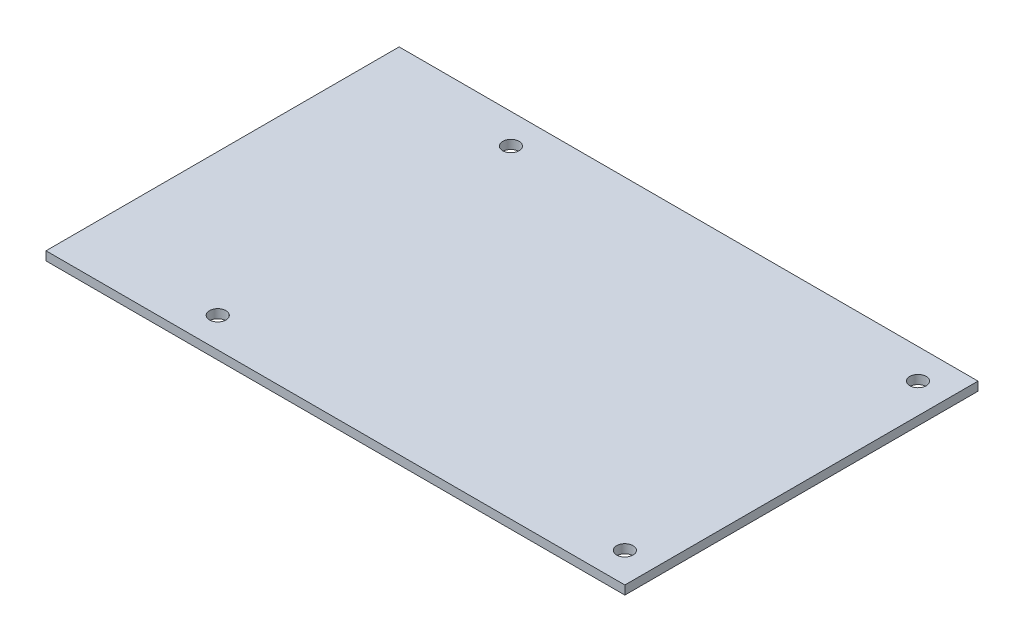
from build123d import *

# Parameters (mm, degrees)
SKETCH1_W           = 106.172
SKETCH1_H           = 64.77
BOSS_EXTRUDE1_DEPTH = 1.6129
SKETCH2_R           = 1.5
CUT_EXTRUDE1_DEPTH  = 1.6129


with BuildPart() as part:
    # Sketch1 → Boss-Extrude1 (new body)
    with BuildSketch(Plane(origin=(0, 0, 0), x_dir=(1, 0, 0), z_dir=(0, 1, 0))):
        Rectangle(SKETCH1_W, SKETCH1_H)
    extrude(amount=BOSS_EXTRUDE1_DEPTH)

    # Sketch2 → Cut-Extrude1 (cut)
    with BuildSketch(Plane(origin=(0, 1.6129, 0), x_dir=(1, 0, 0), z_dir=(0, 1, 0))):
        with Locations(Location((47.586, 26.885, 0), (0, 0, 270))):
            Circle(SKETCH2_R)
        with Locations(Location((47.586, -26.885, 0), (0, 0, 270))):
            Circle(SKETCH2_R)
        with Locations(Location((-27.086, -26.885, 0), (0, 0, 270))):
            Circle(SKETCH2_R)
        with Locations(Location((-27.086, 26.885, 0), (0, 0, 270))):
            Circle(SKETCH2_R)
    extrude(amount=-CUT_EXTRUDE1_DEPTH, mode=Mode.SUBTRACT)


solid = part.part
